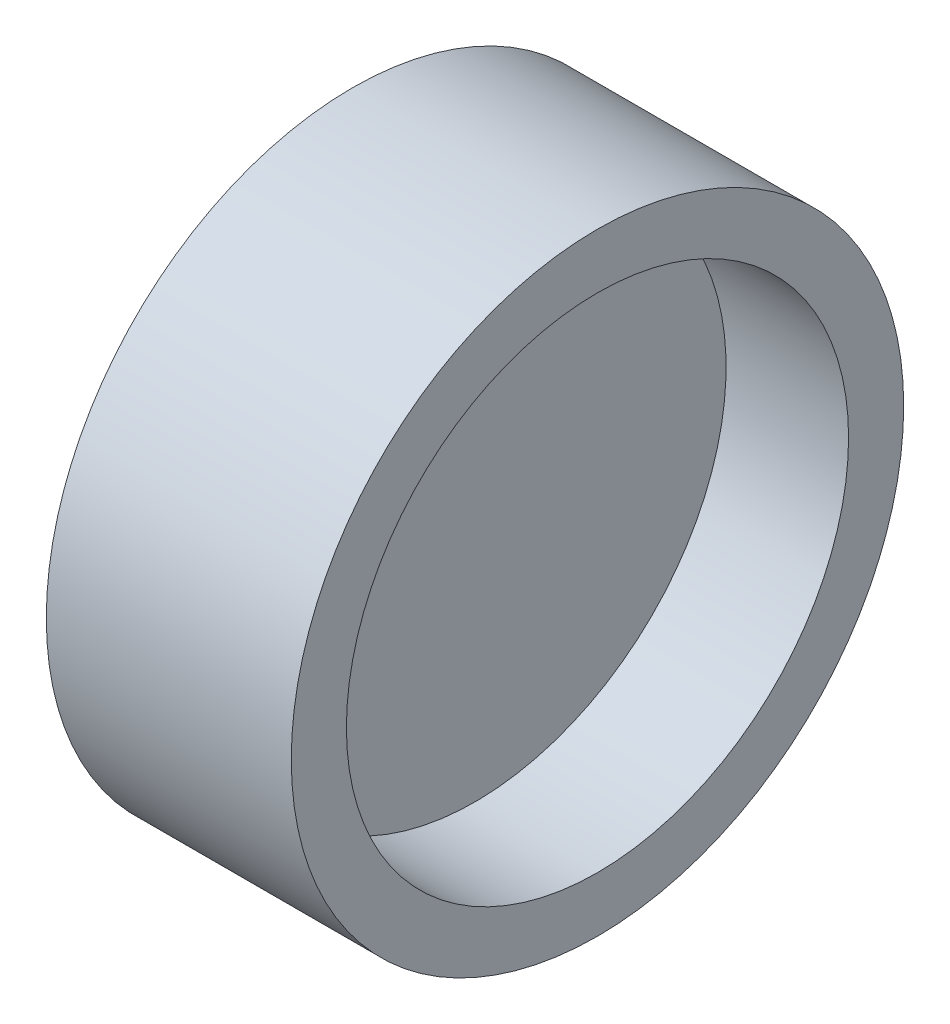
from build123d import *

# Parameters (mm, degrees)
SKETCH1_R           = 5
SKETCH1_R_2         = 4.1
BOSS_EXTRUDE1_DEPTH = 4
SKETCH2_R           = 4.1
SKETCH2_R_2         = 2.1
BOSS_EXTRUDE2_DEPTH = 2
BOSS_EXTRUDE3_START = -0.5
SKETCH3_R           = 2.1
BOSS_EXTRUDE3_DEPTH = 0.5


with BuildPart() as part:
    # Sketch1 → Boss-Extrude1 (new body)
    with BuildSketch(Plane(origin=(0, 0, 0), x_dir=(0, 0, -1), z_dir=(1, 0, 0))):
        Circle(SKETCH1_R)
        Circle(SKETCH1_R_2, mode=Mode.SUBTRACT)
    extrude(amount=BOSS_EXTRUDE1_DEPTH)

    # Sketch2 → Boss-Extrude2 (add)
    with BuildSketch(Plane.ZY):
        Circle(SKETCH2_R)
        Circle(SKETCH2_R_2, mode=Mode.SUBTRACT)
    extrude(amount=-BOSS_EXTRUDE2_DEPTH)

    # Sketch3 → Boss-Extrude3 (add)
    with BuildSketch(Plane(origin=(2, 0, 0), x_dir=(0, 0, -1), z_dir=(1, 0, 0)).offset(BOSS_EXTRUDE3_START)):
        with Locations(Location((0, 0, 0), (0, 0, 180))):
            Circle(SKETCH3_R)
    extrude(amount=BOSS_EXTRUDE3_DEPTH)


solid = part.part
